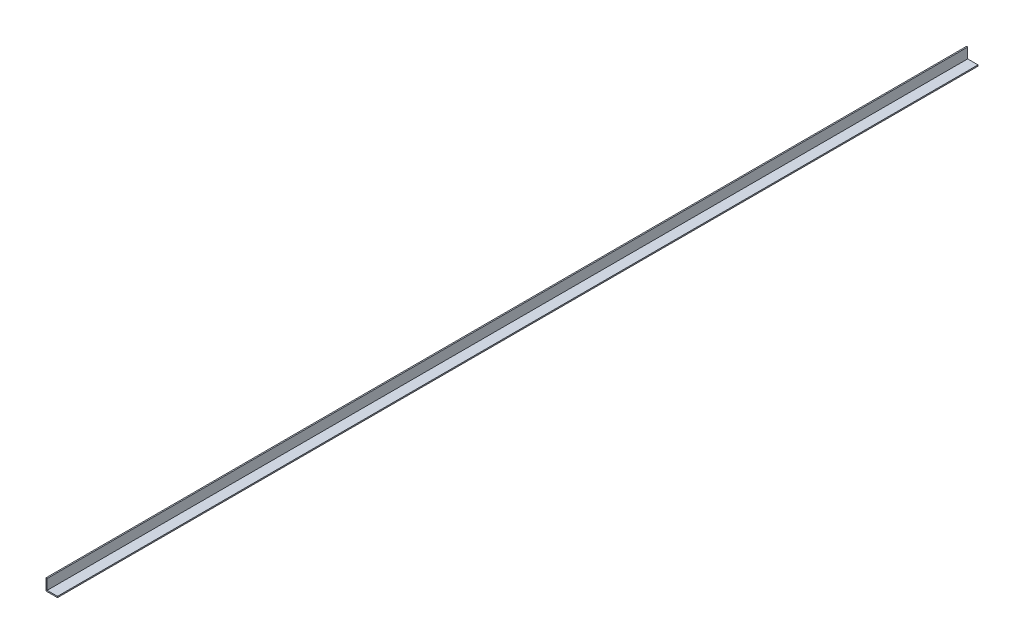
from build123d import *

# Parameters (mm, degrees)
SALIENTE_EXTRUIR1_DEPTH = 6100


with BuildPart() as part:
    # Croquis1 → Saliente-Extruir1 (new body)
    with BuildSketch(Plane.XY):
        Polygon((0, 76.2), (0, 0), (76.2, 0), (76.2, 7.94), (7.94, 7.94), (7.94, 76.2), align=None)
    extrude(amount=-SALIENTE_EXTRUIR1_DEPTH)


solid = part.part
